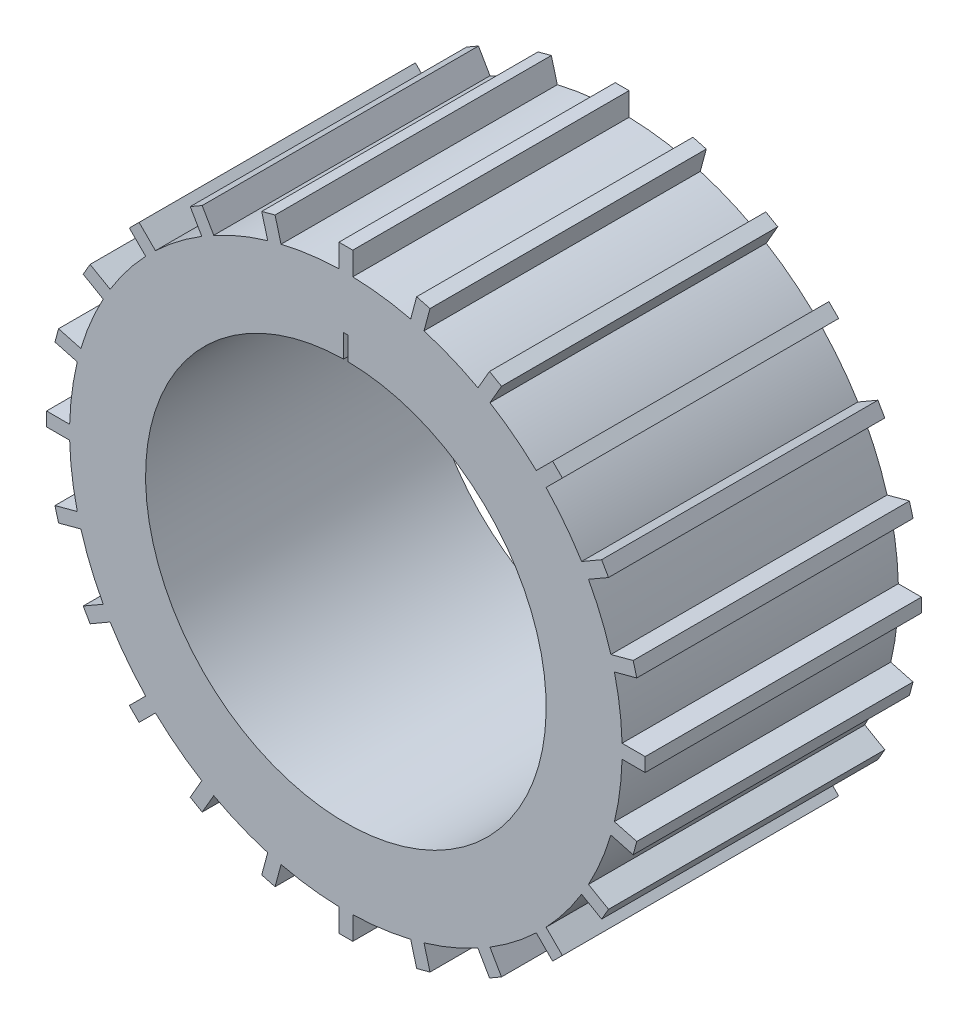
from build123d import *

# Parameters (mm, degrees)
SKETCH1_R           = 60
SKETCH1_R_2         = 43.5
EXTRUSION1_DEPTH    = 60
EXTRUSION3_START    = -60
EXTRUSION3_DEPTH    = 60
BOSS_EXTRUDE1_START = -60
BOSS_EXTRUDE1_DEPTH = 60


with BuildPart() as part:
    # Sketch1 → Extrusion1 (new body)
    with BuildSketch(Plane.XY):
        Circle(SKETCH1_R)
        Circle(SKETCH1_R_2, mode=Mode.SUBTRACT)
    extrude(amount=EXTRUSION1_DEPTH)

    # Sketch3 → Extrusion3 (cut)
    with BuildSketch(Plane.XY.offset(60).offset(EXTRUSION3_START)):
        with BuildLine():
            Line((-0.5, 48.5), (-0.5, 43.497126342))
            ThreePointArc((-0.5, 43.497126342), (0, 43.5), (0.5, 43.497126342))
            Line((0.5, 43.497126342), (0.5, 48.5))
            Line((0.5, 48.5), (-0.5, 48.5))
        make_face()
    extrude(amount=EXTRUSION3_DEPTH, mode=Mode.SUBTRACT)

    # Sketch4 → Boss-Extrude1 (add)
    with BuildSketch(Plane.XY.offset(60).offset(BOSS_EXTRUDE1_START)):
        with BuildLine():
            Line((14.075400351, 58.325664205), (15.374349192, 63.173407276))
            Line((15.374349192, 63.173407276), (18.272126671, 62.396950141))
            Line((18.272126671, 62.396950141), (16.97317783, 57.54920707))
            ThreePointArc((16.97317783, 57.54920707), (15.529142706, 57.955549577), (14.075400351, 58.325664205))
        make_face()
        with BuildLine():
            Line((1.5, 59.981247069), (1.5, 65))
            Line((1.5, 65), (-1.5, 65))
            Line((-1.5, 65), (-1.5, 59.981247069))
            ThreePointArc((-1.5, 59.981247069), (0, 60), (1.5, 59.981247069))
        make_face()
        with BuildLine():
            Line((28.691585429, 52.695283713), (31.200961894, 57.041651246))
            Line((31.200961894, 57.041651246), (33.799038106, 55.541651246))
            Line((33.799038106, 55.541651246), (31.28966164, 51.195283713))
            ThreePointArc((31.28966164, 51.195283713), (30, 51.961524227), (28.691585429, 52.695283713))
        make_face()
        with BuildLine():
            Line((41.352486375, 43.473806719), (44.901280605, 47.022600949))
            Line((44.901280605, 47.022600949), (47.022600949, 44.901280605))
            Line((47.022600949, 44.901280605), (43.473806719, 41.352486375))
            ThreePointArc((43.473806719, 41.352486375), (42.426406871, 42.426406871), (41.352486375, 43.473806719))
        make_face()
        with BuildLine():
            Line((51.195283713, 31.28966164), (55.541651246, 33.799038106))
            Line((55.541651246, 33.799038106), (57.041651246, 31.200961894))
            Line((57.041651246, 31.200961894), (52.695283713, 28.691585429))
            ThreePointArc((52.695283713, 28.691585429), (51.961524227, 30), (51.195283713, 31.28966164))
        make_face()
        with BuildLine():
            Line((57.54920707, 16.97317783), (62.396950141, 18.272126671))
            Line((62.396950141, 18.272126671), (63.173407276, 15.374349192))
            Line((63.173407276, 15.374349192), (58.325664205, 14.075400351))
            ThreePointArc((58.325664205, 14.075400351), (57.955549577, 15.529142706), (57.54920707, 16.97317783))
        make_face()
        with BuildLine():
            Line((59.981247069, 1.5), (65, 1.5))
            Line((65, 1.5), (65, -1.5))
            Line((65, -1.5), (59.981247069, -1.5))
            ThreePointArc((59.981247069, -1.5), (60, 0), (59.981247069, 1.5))
        make_face()
        with BuildLine():
            Line((58.325664205, -14.075400351), (63.173407276, -15.374349192))
            Line((63.173407276, -15.374349192), (62.396950141, -18.272126671))
            Line((62.396950141, -18.272126671), (57.54920707, -16.97317783))
            ThreePointArc((57.54920707, -16.97317783), (57.955549577, -15.529142706), (58.325664205, -14.075400351))
        make_face()
        with BuildLine():
            Line((52.695283713, -28.691585429), (57.041651246, -31.200961894))
            Line((57.041651246, -31.200961894), (55.541651246, -33.799038106))
            Line((55.541651246, -33.799038106), (51.195283713, -31.28966164))
            ThreePointArc((51.195283713, -31.28966164), (51.961524227, -30), (52.695283713, -28.691585429))
        make_face()
        with BuildLine():
            Line((43.473806719, -41.352486375), (47.022600949, -44.901280605))
            Line((47.022600949, -44.901280605), (44.901280605, -47.022600949))
            Line((44.901280605, -47.022600949), (41.352486375, -43.473806719))
            ThreePointArc((41.352486375, -43.473806719), (42.426406871, -42.426406871), (43.473806719, -41.352486375))
        make_face()
        with BuildLine():
            Line((31.28966164, -51.195283713), (33.799038106, -55.541651246))
            Line((33.799038106, -55.541651246), (31.200961894, -57.041651246))
            Line((31.200961894, -57.041651246), (28.691585429, -52.695283713))
            ThreePointArc((28.691585429, -52.695283713), (30, -51.961524227), (31.28966164, -51.195283713))
        make_face()
        with BuildLine():
            Line((16.97317783, -57.54920707), (18.272126671, -62.396950141))
            Line((18.272126671, -62.396950141), (15.374349192, -63.173407276))
            Line((15.374349192, -63.173407276), (14.075400351, -58.325664205))
            ThreePointArc((14.075400351, -58.325664205), (15.529142706, -57.955549577), (16.97317783, -57.54920707))
        make_face()
        with BuildLine():
            Line((1.5, -59.981247069), (1.5, -65))
            Line((1.5, -65), (-1.5, -65))
            Line((-1.5, -65), (-1.5, -59.981247069))
            ThreePointArc((-1.5, -59.981247069), (0, -60), (1.5, -59.981247069))
        make_face()
        with BuildLine():
            Line((-14.075400351, -58.325664205), (-15.374349192, -63.173407276))
            Line((-15.374349192, -63.173407276), (-18.272126671, -62.396950141))
            Line((-18.272126671, -62.396950141), (-16.97317783, -57.54920707))
            ThreePointArc((-16.97317783, -57.54920707), (-15.529142706, -57.955549577), (-14.075400351, -58.325664205))
        make_face()
        with BuildLine():
            Line((-28.691585429, -52.695283713), (-31.200961894, -57.041651246))
            Line((-31.200961894, -57.041651246), (-33.799038106, -55.541651246))
            Line((-33.799038106, -55.541651246), (-31.28966164, -51.195283713))
            ThreePointArc((-31.28966164, -51.195283713), (-30, -51.961524227), (-28.691585429, -52.695283713))
        make_face()
        with BuildLine():
            Line((-41.352486375, -43.473806719), (-44.901280605, -47.022600949))
            Line((-44.901280605, -47.022600949), (-47.022600949, -44.901280605))
            Line((-47.022600949, -44.901280605), (-43.473806719, -41.352486375))
            ThreePointArc((-43.473806719, -41.352486375), (-42.426406871, -42.426406871), (-41.352486375, -43.473806719))
        make_face()
        with BuildLine():
            Line((-51.195283713, -31.28966164), (-55.541651246, -33.799038106))
            Line((-55.541651246, -33.799038106), (-57.041651246, -31.200961894))
            Line((-57.041651246, -31.200961894), (-52.695283713, -28.691585429))
            ThreePointArc((-52.695283713, -28.691585429), (-51.961524227, -30), (-51.195283713, -31.28966164))
        make_face()
        with BuildLine():
            Line((-57.54920707, -16.97317783), (-62.396950141, -18.272126671))
            Line((-62.396950141, -18.272126671), (-63.173407276, -15.374349192))
            Line((-63.173407276, -15.374349192), (-58.325664205, -14.075400351))
            ThreePointArc((-58.325664205, -14.075400351), (-57.955549577, -15.529142706), (-57.54920707, -16.97317783))
        make_face()
        with BuildLine():
            Line((-59.981247069, -1.5), (-65, -1.5))
            Line((-65, -1.5), (-65, 1.5))
            Line((-65, 1.5), (-59.981247069, 1.5))
            ThreePointArc((-59.981247069, 1.5), (-60, 0), (-59.981247069, -1.5))
        make_face()
        with BuildLine():
            Line((-58.325664205, 14.075400351), (-63.173407276, 15.374349192))
            Line((-63.173407276, 15.374349192), (-62.396950141, 18.272126671))
            Line((-62.396950141, 18.272126671), (-57.54920707, 16.97317783))
            ThreePointArc((-57.54920707, 16.97317783), (-57.955549577, 15.529142706), (-58.325664205, 14.075400351))
        make_face()
        with BuildLine():
            Line((-52.695283713, 28.691585429), (-57.041651246, 31.200961894))
            Line((-57.041651246, 31.200961894), (-55.541651246, 33.799038106))
            Line((-55.541651246, 33.799038106), (-51.195283713, 31.28966164))
            ThreePointArc((-51.195283713, 31.28966164), (-51.961524227, 30), (-52.695283713, 28.691585429))
        make_face()
        with BuildLine():
            Line((-43.473806719, 41.352486375), (-47.022600949, 44.901280605))
            Line((-47.022600949, 44.901280605), (-44.901280605, 47.022600949))
            Line((-44.901280605, 47.022600949), (-41.352486375, 43.473806719))
            ThreePointArc((-41.352486375, 43.473806719), (-42.426406871, 42.426406871), (-43.473806719, 41.352486375))
        make_face()
        with BuildLine():
            Line((-31.28966164, 51.195283713), (-33.799038106, 55.541651246))
            Line((-33.799038106, 55.541651246), (-31.200961894, 57.041651246))
            Line((-31.200961894, 57.041651246), (-28.691585429, 52.695283713))
            ThreePointArc((-28.691585429, 52.695283713), (-30, 51.961524227), (-31.28966164, 51.195283713))
        make_face()
        with BuildLine():
            Line((-16.97317783, 57.54920707), (-18.272126671, 62.396950141))
            Line((-18.272126671, 62.396950141), (-15.374349192, 63.173407276))
            Line((-15.374349192, 63.173407276), (-14.075400351, 58.325664205))
            ThreePointArc((-14.075400351, 58.325664205), (-15.529142706, 57.955549577), (-16.97317783, 57.54920707))
        make_face()
    extrude(amount=BOSS_EXTRUDE1_DEPTH)


solid = part.part
